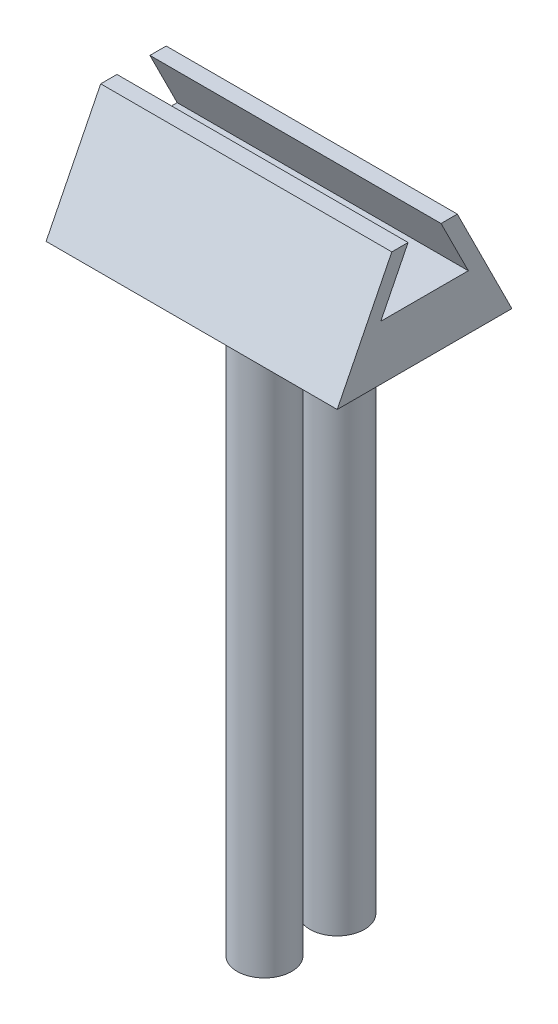
from build123d import *

# Parameters (mm, degrees)
SKETCH1_W           = 80
SKETCH1_H           = 48
BOSS_EXTRUDE1_DEPTH = 30
CUT_EXTRUDE1_DEPTH  = 99
CUT_EXTRUDE2_DEPTH  = 99
SKETCH4_R           = 7.5
BOSS_EXTRUDE2_DEPTH = 160


with BuildPart() as part:
    # Sketch1 → Boss-Extrude1 (new body)
    with BuildSketch(Plane(origin=(0, 0, 0), x_dir=(1, 0, 0), z_dir=(0, 1, 0))):
        with Locations((-40, 24)):
            Rectangle(SKETCH1_W, SKETCH1_H)
    extrude(amount=BOSS_EXTRUDE1_DEPTH)

    # Sketch2 → Cut-Extrude1 (cut, through all)
    with BuildSketch(Plane(origin=(0, 0, 0), x_dir=(0, 0, -1), z_dir=(1, 0, 0))):
        Polygon((0, 0), (15, 30), (0, 30), align=None)
        Polygon((48, 0), (33, 30), (48, 30), align=None)
    extrude(amount=-CUT_EXTRUDE1_DEPTH, mode=Mode.SUBTRACT)

    # Sketch3 → Cut-Extrude2 (cut, through all)
    with BuildSketch(Plane(origin=(0, 0, 0), x_dir=(0, 0, -1), z_dir=(1, 0, 0))):
        Polygon((19.472135955, 30), (11.972135955, 15), (36.027864045, 15), (28.527864045, 30), align=None)
    extrude(amount=-CUT_EXTRUDE2_DEPTH, mode=Mode.SUBTRACT)

    # Sketch4 → Boss-Extrude2 (add)
    with BuildSketch(Plane.XZ):
        with Locations(Location((-40, -20, 0), (0, 0, 270))):
            Circle(SKETCH4_R)
        with Locations(Location((-40, -40, 0), (0, 0, 90))):
            Circle(SKETCH4_R)
    extrude(amount=BOSS_EXTRUDE2_DEPTH)


solid = part.part
